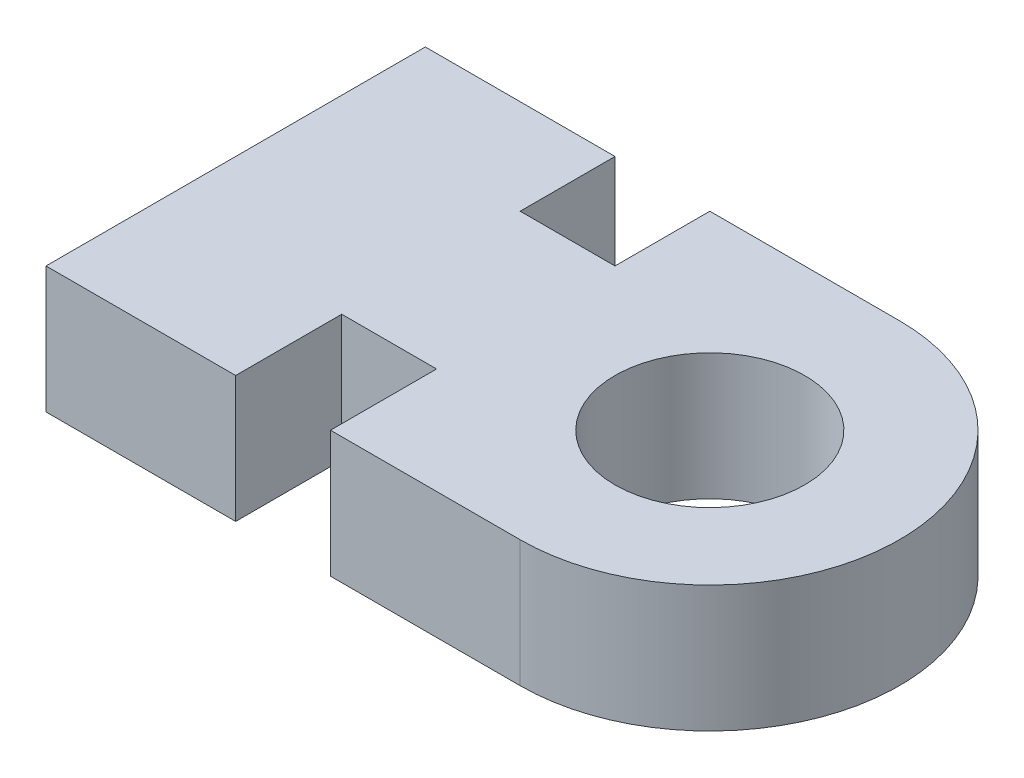
from build123d import *

# Parameters (mm, degrees)
SKETCH_1_R      = 15
EXTRUDE_1_DEPTH = 20


with BuildPart() as part:
    # 草圖1 → 填料-伸長1 (new body)
    with BuildSketch(Plane(origin=(0, 0, 0), x_dir=(1, 0, 0), z_dir=(0, 1, 0))):
        with BuildLine():
            Line((0, 30), (-30, 30))
            Line((-30, 30), (-30, 15))
            Line((-30, 15), (-45, 15))
            Line((-45, 15), (-45, 30))
            Line((-45, 30), (-75, 30))
            Line((-75, 30), (-75, -30))
            Line((-75, -30), (-45, -30))
            Line((-45, -30), (-45, -13.222878726))
            Line((-45, -13.222878726), (-30, -13.222878726))
            Line((-30, -13.222878726), (-30, -30))
            Line((-30, -30), (0, -30))
            ThreePointArc((0, -30), (30, 0), (0, 30))
        make_face()
        with Locations(Location((0, 0, 0), (0, 0, 270))):
            Circle(SKETCH_1_R, mode=Mode.SUBTRACT)
    extrude(amount=EXTRUDE_1_DEPTH)


solid = part.part
